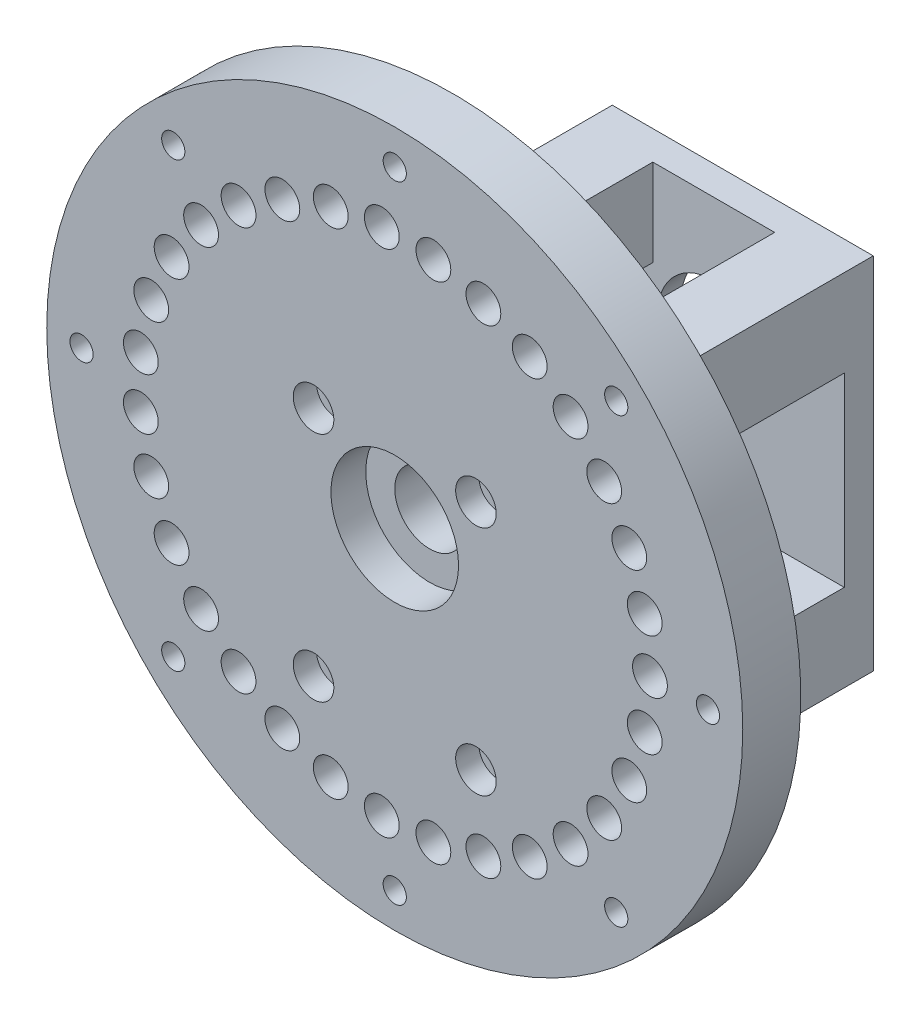
from build123d import *

# Parameters (mm, degrees)
SKETCH1_R               = 3
SKETCH1_R_2             = 11
BOSS_EXTRUDE1_DEPTH     = 5
BOSS_EXTRUDE2_START     = 5
SKETCH2_R               = 60
SKETCH2_R_2             = 6
BOSS_EXTRUDE2_DEPTH     = 5
SKETCH3_R               = 2
CUT_EXTRUDE1_DEPTH      = 35
CUT_EXTRUDE2_START      = -1
SKETCH4_R               = 11
CUT_EXTRUDE2_DEPTH      = 1
CUT_EXTRUDE3_DEPTH      = 87.852680842
CUT_EXTRUDE3_DEPTH_BACK = 87.852680842
SKETCH5_R               = 2
SKETCH6_W               = 45
SKETCH6_H               = 62
BOSS_EXTRUDE3_DEPTH     = 50
CUT_EXTRUDE4_START      = -40
SKETCH7_R               = 2
SKETCH7_R_2             = 6
CUT_EXTRUDE4_DEPTH      = 40
CUT_EXTRUDE5_DEPTH      = 88
CUT_EXTRUDE5_DEPTH_BACK = 5
SKETCH8_R               = 9.6
SKETCH9_W               = 40
SKETCH9_H               = 32
CUT_EXTRUDE6_DEPTH      = 71
SKETCH10_R              = 3.5
CUT_EXTRUDE7_DEPTH      = 4
FILLET1_R               = 4
SKETCH11_W              = 40
SKETCH11_H              = 58
CUT_EXTRUDE8_DEPTH      = 1
SKETCH12_W              = 21
SKETCH12_H              = 36
CUT_EXTRUDE9_DEPTH      = 88
CUT_EXTRUDE10_START     = -88
SKETCH13_R              = 2
CUT_EXTRUDE10_DEPTH     = 88
CUT_EXTRUDE11_START     = -10
SKETCH14_R              = 82.644594736
SKETCH14_R_2            = 60
CUT_EXTRUDE11_DEPTH     = 10
SKETCH15_R              = 4.1
CUT_EXTRUDE12_DEPTH     = 2


with BuildPart() as part:
    # Sketch1 → Boss-Extrude1 (new body)
    with BuildSketch(Plane.XY):
        with BuildLine():
            ThreePointArc((59.966830941, 1.994789941), (-60, 0), (59.966830941, -1.994789941))
            ThreePointArc((59.966830941, -1.994789941), (61.995065687, 0), (59.966830941, 1.994789941))
        make_face()
        with Locations((44, 0)):
            Circle(SKETCH1_R, mode=Mode.SUBTRACT)
        with Locations((43.099317415, -8.857134884)):
            Circle(SKETCH1_R, mode=Mode.SUBTRACT)
        with Locations((40.434143711, -17.351657625)):
            Circle(SKETCH1_R, mode=Mode.SUBTRACT)
        with Locations((36.113591413, -25.135801464)):
            Circle(SKETCH1_R, mode=Mode.SUBTRACT)
        with Locations((30.314544439, -31.890882638)):
            Circle(SKETCH1_R, mode=Mode.SUBTRACT)
        with Locations((23.274416454, -37.34034733)):
            Circle(SKETCH1_R, mode=Mode.SUBTRACT)
        with Locations((15.281431125, -41.261093814)):
            Circle(SKETCH1_R, mode=Mode.SUBTRACT)
        with Locations((6.66282221, -43.49260627)):
            Circle(SKETCH1_R, mode=Mode.SUBTRACT)
        with Locations((-2.228563429, -43.943526316)):
            Circle(SKETCH1_R, mode=Mode.SUBTRACT)
        with Locations((-11.028711419, -42.59539323)):
            Circle(SKETCH1_R, mode=Mode.SUBTRACT)
        with Locations((-19.377342669, -39.503399741)):
            Circle(SKETCH1_R, mode=Mode.SUBTRACT)
        with Locations((-26.932663232, -34.794132425)):
            Circle(SKETCH1_R, mode=Mode.SUBTRACT)
        with Locations((-33.385357398, -28.66038924)):
            Circle(SKETCH1_R, mode=Mode.SUBTRACT)
        with Locations((-38.47125111, -21.353286351)):
            Circle(SKETCH1_R, mode=Mode.SUBTRACT)
        with Locations((-41.982127282, -13.171977411)):
            Circle(SKETCH1_R, mode=Mode.SUBTRACT)
        with Locations((-43.774250229, -4.451406167)):
            Circle(SKETCH1_R, mode=Mode.SUBTRACT)
        with Locations((-43.774250229, 4.451406167)):
            Circle(SKETCH1_R, mode=Mode.SUBTRACT)
        with Locations((-41.982127282, 13.171977411)):
            Circle(SKETCH1_R, mode=Mode.SUBTRACT)
        with Locations((-38.47125111, 21.353286351)):
            Circle(SKETCH1_R, mode=Mode.SUBTRACT)
        with Locations((-33.385357398, 28.66038924)):
            Circle(SKETCH1_R, mode=Mode.SUBTRACT)
        with Locations((-26.932663232, 34.794132425)):
            Circle(SKETCH1_R, mode=Mode.SUBTRACT)
        with Locations((-19.377342669, 39.503399741)):
            Circle(SKETCH1_R, mode=Mode.SUBTRACT)
        with Locations((-11.028711419, 42.59539323)):
            Circle(SKETCH1_R, mode=Mode.SUBTRACT)
        with Locations((-2.228563429, 43.943526316)):
            Circle(SKETCH1_R, mode=Mode.SUBTRACT)
        with Locations((6.66282221, 43.49260627)):
            Circle(SKETCH1_R, mode=Mode.SUBTRACT)
        with Locations((15.281431125, 41.261093814)):
            Circle(SKETCH1_R, mode=Mode.SUBTRACT)
        with Locations((23.274416454, 37.34034733)):
            Circle(SKETCH1_R, mode=Mode.SUBTRACT)
        with Locations((30.314544439, 31.890882638)):
            Circle(SKETCH1_R, mode=Mode.SUBTRACT)
        with Locations((36.113591413, 25.135801464)):
            Circle(SKETCH1_R, mode=Mode.SUBTRACT)
        with Locations((40.434143711, 17.351657625)):
            Circle(SKETCH1_R, mode=Mode.SUBTRACT)
        with Locations((43.099317415, 8.857134884)):
            Circle(SKETCH1_R, mode=Mode.SUBTRACT)
        Circle(SKETCH1_R_2, mode=Mode.SUBTRACT)
    extrude(amount=BOSS_EXTRUDE1_DEPTH)

    # Sketch2 → Boss-Extrude2 (add)
    with BuildSketch(Plane(origin=(0, 0, 0), x_dir=(-1, 0, 0), z_dir=(0, 0, -1)).offset(BOSS_EXTRUDE2_START)):
        Circle(SKETCH2_R)
        Circle(SKETCH2_R_2, mode=Mode.SUBTRACT)
    extrude(amount=-BOSS_EXTRUDE2_DEPTH)

    # Sketch3 → Cut-Extrude1 (cut)
    with BuildSketch(Plane.XY.offset(5)):
        with Locations((0, 54)):
            Circle(SKETCH3_R)
        with Locations((38.183766184, 38.183766184)):
            Circle(SKETCH3_R)
        with Locations((54, 0)):
            Circle(SKETCH3_R)
        with Locations((38.183766184, -38.183766184)):
            Circle(SKETCH3_R)
        with Locations((0, -54)):
            Circle(SKETCH3_R)
        with Locations((-38.183766184, -38.183766184)):
            Circle(SKETCH3_R)
        with Locations((-54, 0)):
            Circle(SKETCH3_R)
        with Locations((-38.183766184, 38.183766184)):
            Circle(SKETCH3_R)
    extrude(amount=-CUT_EXTRUDE1_DEPTH, mode=Mode.SUBTRACT)

    # Sketch4 → Cut-Extrude2 (cut)
    with BuildSketch(Plane.XY.offset(CUT_EXTRUDE2_START)):
        Circle(SKETCH4_R)
    extrude(amount=CUT_EXTRUDE2_DEPTH, mode=Mode.SUBTRACT)

    # Sketch5 → Cut-Extrude3 (cut, two sides: drawn at the far end of the back side and taken through both)
    with BuildSketch(Plane(origin=(0, 0, -5), x_dir=(-1, 0, 0), z_dir=(0, 0, -1)).offset(-CUT_EXTRUDE3_DEPTH_BACK)):
        with Locations((-14, 11)):
            Circle(SKETCH5_R)
        with Locations((14, 11)):
            Circle(SKETCH5_R)
        with Locations((14, -29)):
            Circle(SKETCH5_R)
        with Locations((-14, -29)):
            Circle(SKETCH5_R)
    extrude(amount=CUT_EXTRUDE3_DEPTH + CUT_EXTRUDE3_DEPTH_BACK, mode=Mode.SUBTRACT)

    # Sketch6 → Boss-Extrude3 (add)
    with BuildSketch(Plane(origin=(0, 0, -5), x_dir=(-1, 0, 0), z_dir=(0, 0, -1))):
        with Locations((0, -9)):
            Rectangle(SKETCH6_W, SKETCH6_H)
    extrude(amount=BOSS_EXTRUDE3_DEPTH)

    # Sketch7 → Cut-Extrude4 (cut)
    with BuildSketch(Plane.XY.offset(5).offset(CUT_EXTRUDE4_START)):
        with Locations((-14, 11)):
            Circle(SKETCH7_R)
        with Locations(Location((14, 11, 0), (0, 0, 180))):
            Circle(SKETCH7_R)
        with Locations((14, -29)):
            Circle(SKETCH7_R)
        with Locations(Location((-14, -29, 0), (0, 0, 180))):
            Circle(SKETCH7_R)
        Circle(SKETCH7_R_2)
    extrude(amount=CUT_EXTRUDE4_DEPTH, mode=Mode.SUBTRACT)

    # Sketch8 → Cut-Extrude5 (cut, two sides: drawn at the far end of the back side and taken through both)
    with BuildSketch(Plane(origin=(0, 0, -55), x_dir=(-1, 0, 0), z_dir=(0, 0, -1)).offset(-CUT_EXTRUDE5_DEPTH_BACK)):
        Circle(SKETCH8_R)
    extrude(amount=CUT_EXTRUDE5_DEPTH + CUT_EXTRUDE5_DEPTH_BACK, mode=Mode.SUBTRACT)

    # Sketch9 → Cut-Extrude6 (cut)
    with BuildSketch(Plane.ZY.offset(22.5)):
        with Locations((-30, -9)):
            Rectangle(SKETCH9_W, SKETCH9_H)
    extrude(amount=-CUT_EXTRUDE6_DEPTH, mode=Mode.SUBTRACT)

    # Sketch10 → Cut-Extrude7 (cut)
    with BuildSketch(Plane.XY.offset(5)):
        with Locations((-14, 11)):
            Circle(SKETCH10_R)
        with Locations((14, 11)):
            Circle(SKETCH10_R)
        with Locations((-14, -29)):
            Circle(SKETCH10_R)
        with Locations((14, -29)):
            Circle(SKETCH10_R)
    extrude(amount=-CUT_EXTRUDE7_DEPTH, mode=Mode.SUBTRACT)

    # Fillet1
    fillet1_edges = [part.edges().sort_by_distance(p)[0] for p in [
        (-22.5, -9, -5),
        (0, 22, -5),
        (22.5, -9, -5),
        (0, -40, -5),
    ]]
    fillet(fillet1_edges, radius=FILLET1_R)

    # Sketch11 → Cut-Extrude8 (cut)
    with BuildSketch(Plane(origin=(0, 0, -55), x_dir=(-1, 0, 0), z_dir=(0, 0, -1))):
        with Locations((0, -9)):
            Rectangle(SKETCH11_W, SKETCH11_H)
    extrude(amount=-CUT_EXTRUDE8_DEPTH, mode=Mode.SUBTRACT)

    # Sketch12 → Cut-Extrude9 (cut)
    with BuildSketch(Plane.XZ.offset(40)):
        with Locations((0, -32)):
            Rectangle(SKETCH12_W, SKETCH12_H)
    extrude(amount=-CUT_EXTRUDE9_DEPTH, mode=Mode.SUBTRACT)

    # Sketch13 → Cut-Extrude10 (cut)
    with BuildSketch(Plane.XY.offset(1).offset(CUT_EXTRUDE10_START)):
        with Locations(Location((-14, 11, 0), (0, 0, 180))):
            Circle(SKETCH13_R)
        with Locations(Location((14, 11, 0), (0, 0, 180))):
            Circle(SKETCH13_R)
        with Locations(Location((14, -29, 0), (0, 0, 180))):
            Circle(SKETCH13_R)
        with Locations(Location((-14, -29, 0), (0, 0, 180))):
            Circle(SKETCH13_R)
    extrude(amount=CUT_EXTRUDE10_DEPTH, mode=Mode.SUBTRACT)

    # Sketch14 → Cut-Extrude11 (cut)
    with BuildSketch(Plane.XY.offset(5).offset(CUT_EXTRUDE11_START)):
        Circle(SKETCH14_R)
        with Locations(Location((0, 0, 0), (0, 0, 180))):
            Circle(SKETCH14_R_2, mode=Mode.SUBTRACT)
    extrude(amount=CUT_EXTRUDE11_DEPTH, mode=Mode.SUBTRACT)

    # Sketch15 → Cut-Extrude12 (cut)
    with BuildSketch(Plane(origin=(0, 0, -54), x_dir=(-1, 0, 0), z_dir=(0, 0, -1))):
        with Locations((14, 11)):
            Circle(SKETCH15_R)
        with Locations((-14, 11)):
            Circle(SKETCH15_R)
        with Locations((-14, -29)):
            Circle(SKETCH15_R)
        with Locations((14, -29)):
            Circle(SKETCH15_R)
    extrude(amount=-CUT_EXTRUDE12_DEPTH, mode=Mode.SUBTRACT)


solid = part.part
